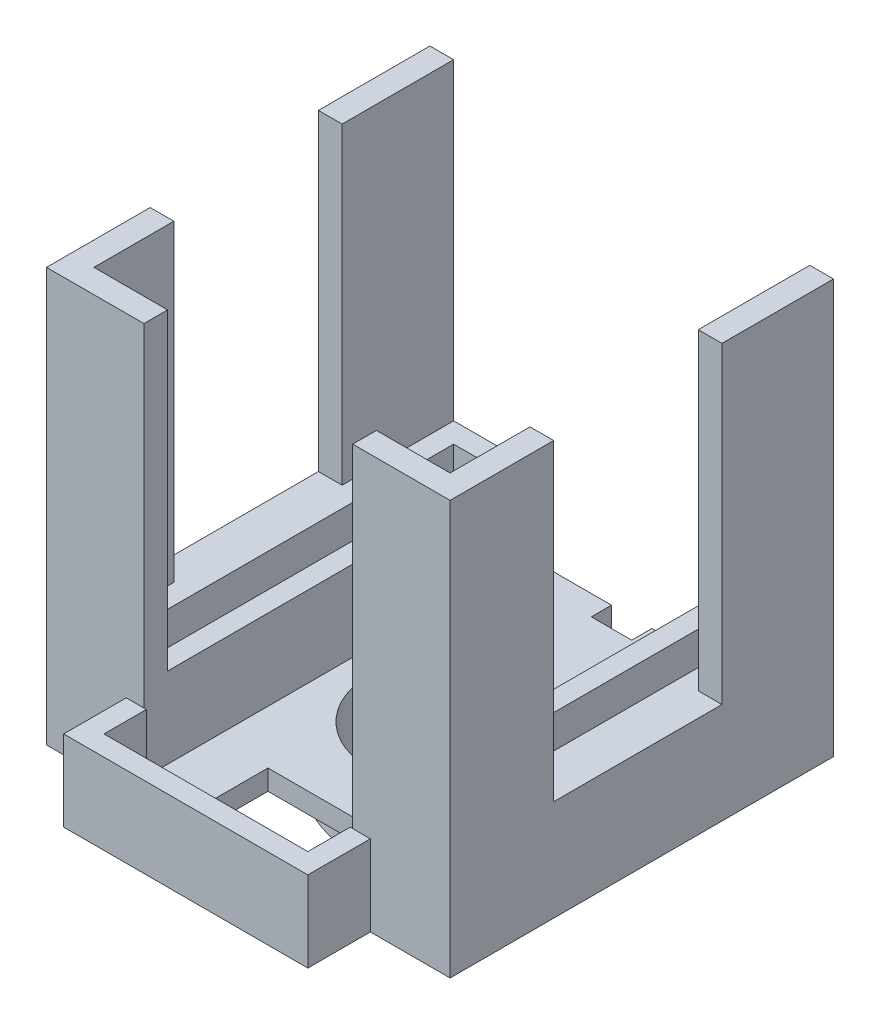
from build123d import *

# Parameters (mm, degrees)
BOSS_EXTRUDE2_DEPTH = 28
SKETCH3_W           = 40
SKETCH3_H           = 38
BOSS_EXTRUDE3_DEPTH = 10
CUT_EXTRUDE2_DEPTH  = 8
SKETCH6_W           = 20.7
SKETCH6_H           = 38
CUT_EXTRUDE3_DEPTH  = 43
CUT_EXTRUDE4_DEPTH  = 43
BOSS_EXTRUDE5_DEPTH = 8
SKETCH10_R          = 10
BOSS_EXTRUDE6_DEPTH = 4
SKETCH11_R          = 8
CUT_EXTRUDE5_DEPTH  = 4
SKETCH12_R          = 8
CUT_EXTRUDE6_DEPTH  = 10
SKETCH13_W          = 3.3
SKETCH13_H          = 31.65
CUT_EXTRUDE7_DEPTH  = 10
SKETCH14_W          = 3.3
SKETCH14_H          = 31.65
CUT_EXTRUDE8_DEPTH  = 10
SKETCH15_W          = 16.679991472
SKETCH15_H          = 28
CUT_EXTRUDE9_DEPTH  = 253
SKETCH16_W          = 10.1
SKETCH16_H          = 7
CUT_EXTRUDE11_DEPTH = 13
SKETCH17_W          = 2.35
SKETCH17_H          = 11.05285785
BOSS_EXTRUDE7_DEPTH = 3


with BuildPart() as part:
    # Sketch1 → Boss-Extrude2 (new body)
    with BuildSketch(Plane(origin=(0, 0, 0), x_dir=(1, 0, 0), z_dir=(0, 1, 0))):
        Polygon((40, -2), (40, -40), (0, -40), (0, -2), (2.35, -2), (2.35, -2.35), (2.35, -20), (2.35, -37.65), (37.65, -37.65), (37.65, -20), (37.65, -2.35), (37.65, -2), align=None)
    extrude(amount=BOSS_EXTRUDE2_DEPTH)

    # Sketch3 → Boss-Extrude3 (add)
    with BuildSketch(Plane.XZ):
        with Locations((20, 21)):
            Rectangle(SKETCH3_W, SKETCH3_H)
    extrude(amount=BOSS_EXTRUDE3_DEPTH)

    # Sketch5 → Cut-Extrude2 (cut)
    with BuildSketch(Plane(origin=(0, 0, 0), x_dir=(1, 0, 0), z_dir=(0, 1, 0))):
        Polygon((9.65, -20), (9.65, -57.9), (20, -57.9), (30.35, -57.9), (30.35, -20), (30.35, -2), (9.65, -2), align=None)
    extrude(amount=-CUT_EXTRUDE2_DEPTH, mode=Mode.SUBTRACT)

    # Sketch6 → Cut-Extrude3 (cut)
    with BuildSketch(Plane(origin=(0, -8, 0), x_dir=(1, 0, 0), z_dir=(0, 1, 0))):
        with Locations((20, -21)):
            Rectangle(SKETCH6_W, SKETCH6_H)
    extrude(amount=CUT_EXTRUDE3_DEPTH, mode=Mode.SUBTRACT)

    # Sketch7 → Cut-Extrude4 (cut)
    with BuildSketch(Plane(origin=(0, -8, 0), x_dir=(1, 0, 0), z_dir=(0, 1, 0))):
        Polygon((20, -4), (18, -4), (18, -2), (22, -2), (22, -4), align=None)
    extrude(amount=-CUT_EXTRUDE4_DEPTH, mode=Mode.SUBTRACT)

    # Sketch9 → Boss-Extrude5 (add)
    with BuildSketch(Plane.XZ.offset(10)):
        Polygon((30.1, 44.2), (30.1, 40), (32.1, 40), (32.1, 46.2), (18, 46.2), (9.9, 46.2), (7.9, 46.2), (7.9, 40), (9.9, 40), (9.9, 44.2), align=None)
    extrude(amount=-BOSS_EXTRUDE5_DEPTH)

    # Sketch10 → Boss-Extrude6 (add)
    with BuildSketch(Plane.XZ.offset(10)):
        with Locations(Location((20, 20, 0), (0, 0, 270))):
            Circle(SKETCH10_R)
    extrude(amount=BOSS_EXTRUDE6_DEPTH)

    # Sketch11 → Cut-Extrude5 (cut)
    with BuildSketch(Plane(origin=(0, -14, 0), x_dir=(-1, 0, 0), z_dir=(0, -1, 0))):
        with Locations(Location((-20, -20, 0), (0, 0, 90))):
            Circle(SKETCH11_R)
    extrude(amount=-CUT_EXTRUDE5_DEPTH, mode=Mode.SUBTRACT)

    # Sketch12 → Cut-Extrude6 (cut)
    with BuildSketch(Plane.XZ.offset(10)):
        with Locations(Location((20, 20, 0), (0, 0, 270))):
            Circle(SKETCH12_R)
    extrude(amount=-CUT_EXTRUDE6_DEPTH, mode=Mode.SUBTRACT)

    # Sketch13 → Cut-Extrude7 (cut)
    with BuildSketch(Plane(origin=(0, 0, 0), x_dir=(1, 0, 0), z_dir=(0, 1, 0))):
        with Locations((6, -19.825)):
            Rectangle(SKETCH13_W, SKETCH13_H)
    extrude(amount=-CUT_EXTRUDE7_DEPTH, mode=Mode.SUBTRACT)

    # Sketch14 → Cut-Extrude8 (cut)
    with BuildSketch(Plane(origin=(0, 0, 0), x_dir=(1, 0, 0), z_dir=(0, 1, 0))):
        with Locations((34, -19.825)):
            Rectangle(SKETCH14_W, SKETCH14_H)
    extrude(amount=-CUT_EXTRUDE8_DEPTH, mode=Mode.SUBTRACT)

    # Sketch15 → Cut-Extrude9 (cut)
    with BuildSketch(Plane(origin=(40, 0, 0), x_dir=(0, 0, -1), z_dir=(1, 0, 0))):
        with Locations((-21.392853586, 14)):
            Rectangle(SKETCH15_W, SKETCH15_H)
    extrude(amount=-CUT_EXTRUDE9_DEPTH, mode=Mode.SUBTRACT)

    # Sketch16 → Cut-Extrude11 (cut)
    with BuildSketch(Plane.XZ.offset(10)):
        with Locations((20, 36.5)):
            Rectangle(SKETCH16_W, SKETCH16_H)
    extrude(amount=-CUT_EXTRUDE11_DEPTH, mode=Mode.SUBTRACT)

    # Sketch17 → Boss-Extrude7 (add)
    with BuildSketch(Plane(origin=(0, 28, 0), x_dir=(1, 0, 0), z_dir=(0, 1, 0))):
        Polygon((40, -40), (40, -29.732849322), (37.65, -29.732849322), (37.65, -37.65), (30.35, -37.65), (30.35, -40), align=None)
        Polygon((9.65, -40), (0, -40), (0, -29.732849322), (2.35, -29.732849322), (2.35, -37.65), (9.65, -37.65), align=None)
        with Locations((1.175, -7.526428925)):
            Rectangle(SKETCH17_W, SKETCH17_H)
        with Locations((38.825, -7.526428925)):
            Rectangle(SKETCH17_W, SKETCH17_H)
    extrude(amount=BOSS_EXTRUDE7_DEPTH)


solid = part.part
